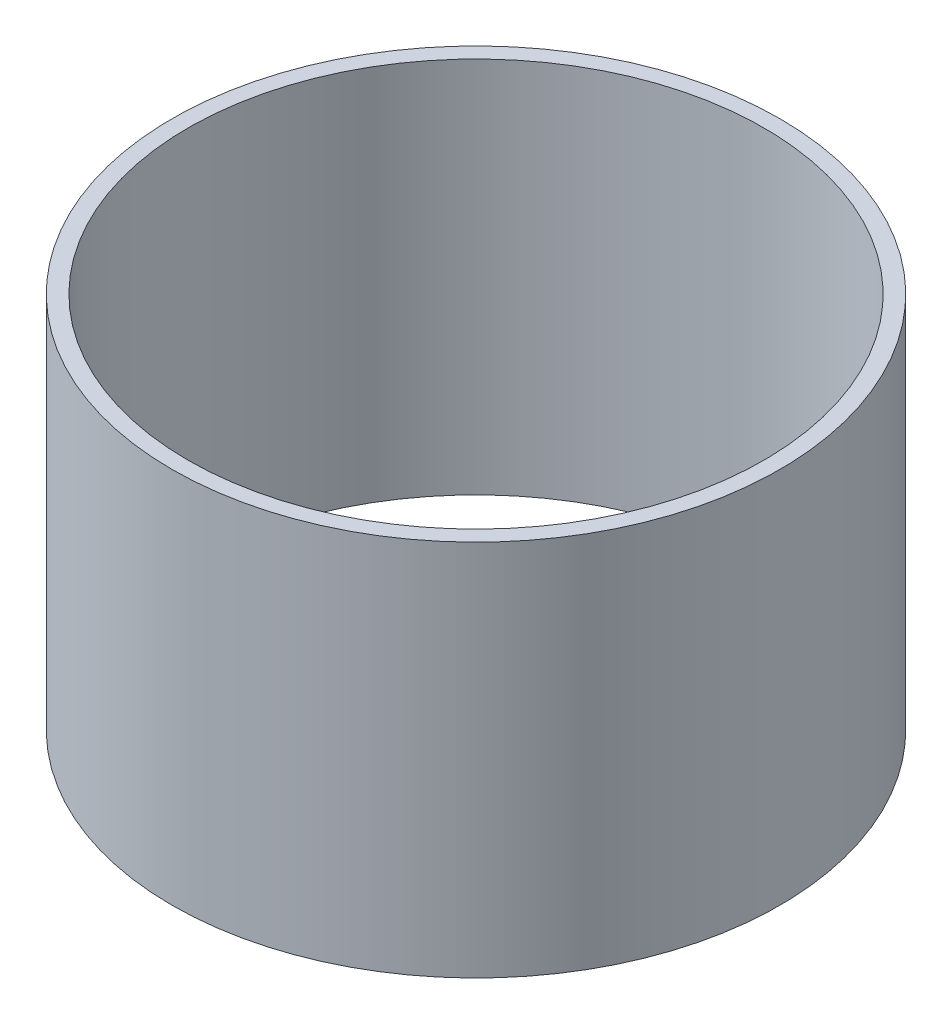
from build123d import *

# Parameters (mm, degrees)
SKETCH1_R           = 24.15
SKETCH1_R_2         = 22.88
BOSS_EXTRUDE1_DEPTH = 30


with BuildPart() as part:
    # Sketch1 → Boss-Extrude1 (new body)
    with BuildSketch(Plane(origin=(0, 0, 0), x_dir=(1, 0, 0), z_dir=(0, 1, 0))):
        with Locations(Location((0, 0, 0), (0, 0, 270))):
            Circle(SKETCH1_R)
        with Locations(Location((0, 0, 0), (0, 0, 270))):
            Circle(SKETCH1_R_2, mode=Mode.SUBTRACT)
    extrude(amount=BOSS_EXTRUDE1_DEPTH)


solid = part.part
